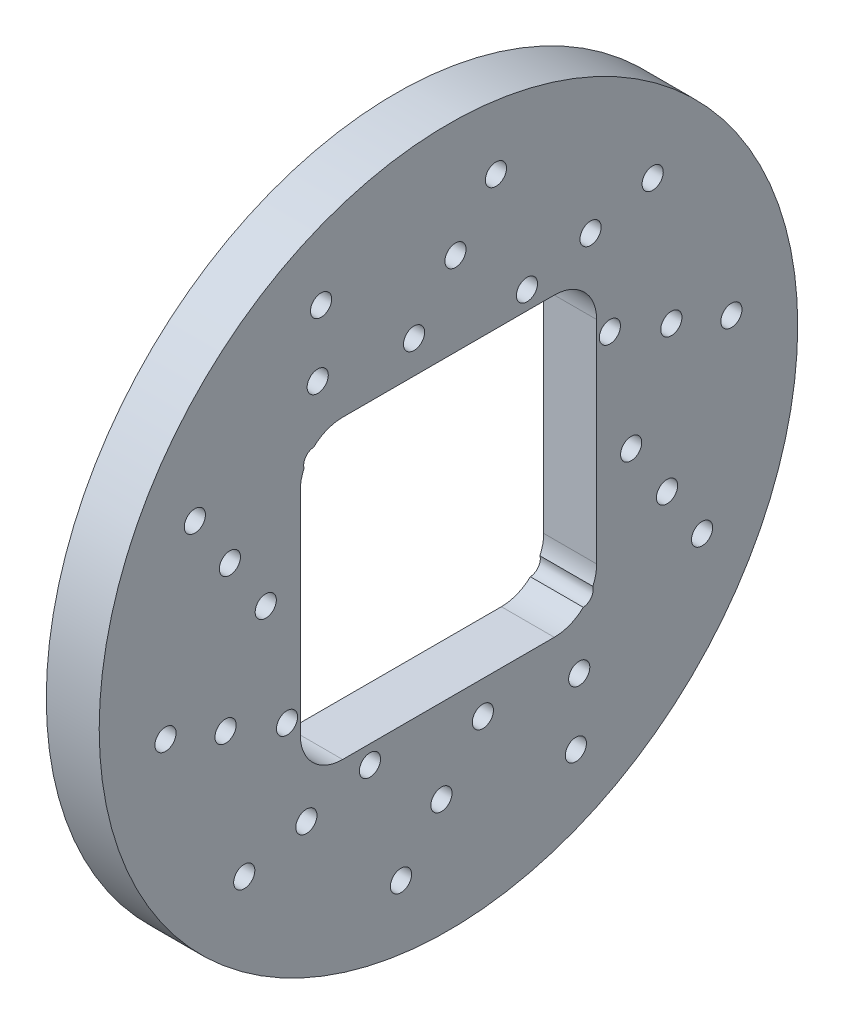
from build123d import *

# Parameters (mm, degrees)
SKETCH1_R           = 16.5
BOSS_EXTRUDE1_DEPTH = 2.5
SKETCH2_W           = 14
SKETCH2_H           = 14
CUT_EXTRUDE2_DEPTH  = 2.5
FILLET1_R           = 2
SKETCH5_R           = 0.5
CUT_EXTRUDE3_DEPTH  = 2.5
CIRPATTERN3_COUNT   = 10


with BuildPart() as part:
    # Sketch1 → Boss-Extrude1 (new body)
    with BuildSketch(Plane(origin=(0, 0, 0), x_dir=(0, 0, -1), z_dir=(1, 0, 0))):
        Circle(SKETCH1_R)
    extrude(amount=BOSS_EXTRUDE1_DEPTH)

    # Sketch2 → Cut-Extrude2 (cut)
    with BuildSketch(Plane(origin=(2.5, 0, 0), x_dir=(0, 0, -1), z_dir=(1, 0, 0))):
        Rectangle(SKETCH2_W, SKETCH2_H)
    extrude(amount=-CUT_EXTRUDE2_DEPTH, mode=Mode.SUBTRACT)

    # Fillet1
    fillet1_edges = [part.edges().sort_by_distance(p)[0] for p in [
        (1.25, -7, -7),
        (1.25, -7, 7),
        (1.25, 7, 7),
        (1.25, 7, -7),
    ]]
    fillet(fillet1_edges, radius=FILLET1_R)

    # Sketch5 → Cut-Extrude3 (cut)
    with BuildSketch(Plane(origin=(2.5, 0, 0), x_dir=(0, 0, -1), z_dir=(1, 0, 0))):
        with Locations((-1.625921047, 8.546877008)):
            Circle(SKETCH5_R)
        with Locations((0.330939682, 10.964175556)):
            Circle(SKETCH5_R)
        with Locations((2.24289984, 13.326008692)):
            Circle(SKETCH5_R)
    cut_extrude3 = extrude(amount=-CUT_EXTRUDE3_DEPTH, mode=Mode.SUBTRACT)

    # CirPattern3: Cut-Extrude3 ×10 about axis
    cirpattern3_axis = Axis((0, 0, 0), (1, 0, 0))
    for i in range(1, CIRPATTERN3_COUNT):
        add(cut_extrude3.rotate(cirpattern3_axis, i * 360 / CIRPATTERN3_COUNT), mode=Mode.SUBTRACT)


solid = part.part
